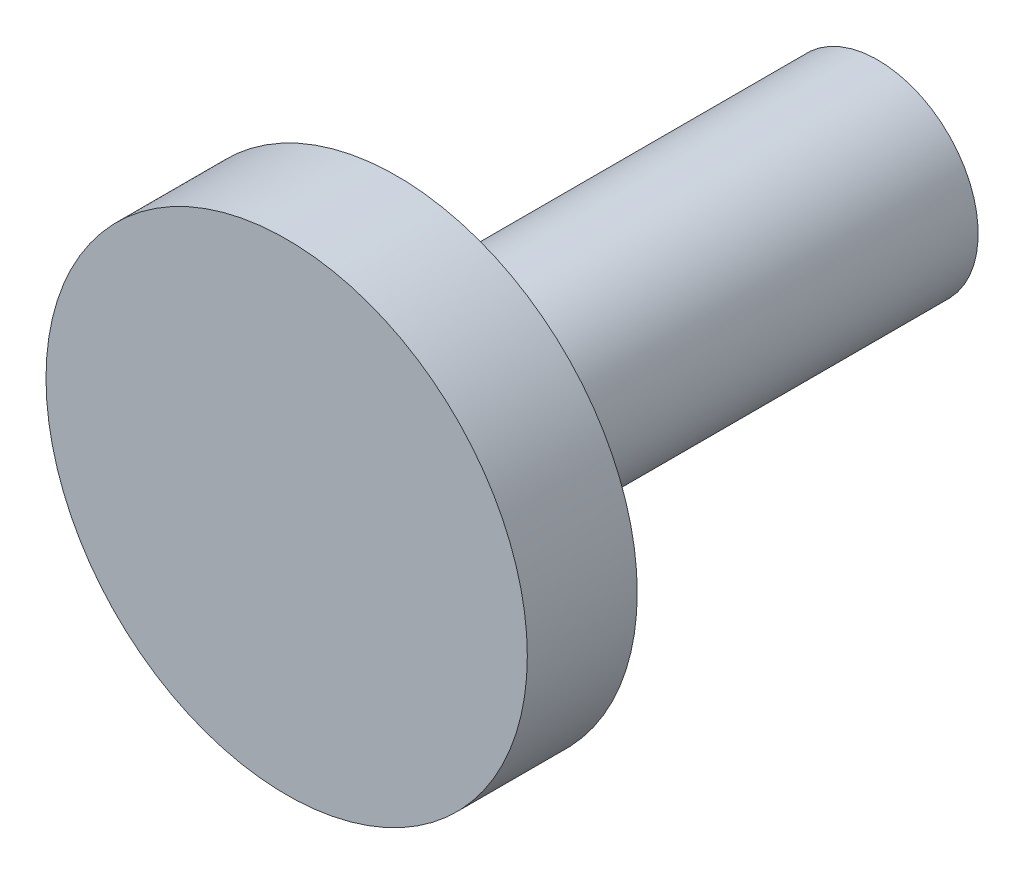
from build123d import *

# Parameters (mm, degrees)
ESQUISSE1_R        = 3
BOSS_EXTRU_1_DEPTH = 1.37
ESQUISSE2_R        = 1.25
BOSS_EXTRU_2_DEPTH = 6


with BuildPart() as part:
    # Esquisse1 → Boss.-Extru.1 (new body)
    with BuildSketch(Plane.XY):
        Circle(ESQUISSE1_R)
    extrude(amount=BOSS_EXTRU_1_DEPTH)

    # Esquisse2 → Boss.-Extru.2 (add)
    with BuildSketch(Plane(origin=(0, 0, 0), x_dir=(-1, 0, 0), z_dir=(0, 0, -1))):
        Circle(ESQUISSE2_R)
    extrude(amount=BOSS_EXTRU_2_DEPTH)


solid = part.part
